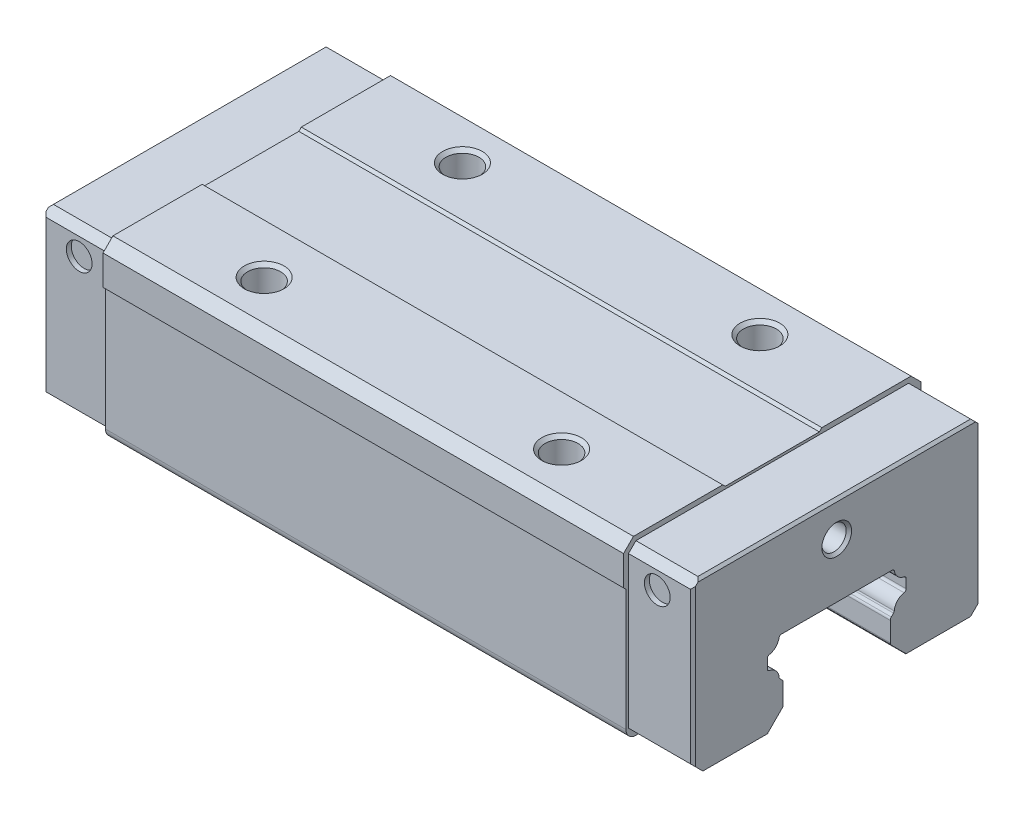
from build123d import *

# Parameters (mm, degrees)
BOSS_EXTRUDE1_DEPTH      = 52.5
BOSS_EXTRUDE1_DEPTH_BACK = 52.5
BOSS_EXTRUDE2_DEPTH      = 13
BOSS_EXTRUDE3_DEPTH      = 13
CUT_EXTRUDE1_DEPTH       = 65.5
CUT_EXTRUDE1_DEPTH_BACK  = 65.5
CUT_EXTRUDE2_DEPTH       = 29
CUT_EXTRUDE2_DEPTH_BACK  = 29
CUT_EXTRUDE3_DEPTH       = 29
CUT_EXTRUDE3_DEPTH_BACK  = 29
SKETCH7_R                = 2.6
CUT_EXTRUDE4_DEPTH       = 1
SKETCH8_R                = 2.6
CUT_EXTRUDE5_DEPTH       = 1
CUT_EXTRUDE6_START       = 1
SKETCH9_R                = 2.6
CUT_EXTRUDE6_DEPTH       = 1
CUT_EXTRUDE7_START       = 1
SKETCH10_R               = 2.6
CUT_EXTRUDE7_DEPTH       = 1
CUT_EXTRUDE8_DEPTH       = 35
CUT_EXTRUDE9_DEPTH       = 35


with BuildPart() as part:
    # Sketch1 → Boss-Extrude1 (new, two sides: drawn at the far end of the back side and taken through both)
    with BuildSketch(Plane(origin=(0, 0, 0), x_dir=(0, 0, -1), z_dir=(1, 0, 0)).offset(-BOSS_EXTRUDE1_DEPTH_BACK)):
        with BuildLine():
            Line((-30, 33), (-30, 27))
            Line((-30, 27), (-29.5, 26.5))
            Line((-29.5, 26.5), (-29.5, 2))
            ThreePointArc((-29.5, 2), (-28.914213562, 0.585786438), (-27.5, 0))
            Line((-27.5, 0), (27.5, 0))
            ThreePointArc((27.5, 0), (28.914213562, 0.585786438), (29.5, 2))
            Line((29.5, 2), (29.5, 26.5))
            Line((29.5, 26.5), (30, 27))
            Line((30, 27), (30, 33))
            Line((30, 33), (28, 35))
            Line((28, 35), (10, 35))
            Line((10, 35), (9.5, 34.5))
            Line((9.5, 34.5), (-9.5, 34.5))
            Line((-9.5, 34.5), (-10, 35))
            Line((-10, 35), (-28, 35))
            Line((-28, 35), (-30, 33))
        make_face()
    extrude(amount=BOSS_EXTRUDE1_DEPTH + BOSS_EXTRUDE1_DEPTH_BACK)

    # Sketch2 → Boss-Extrude2 (add)
    with BuildSketch(Plane(origin=(-65.5, 0, 0), x_dir=(0, 0, -1), z_dir=(1, 0, 0))):
        Polygon((-29, 2), (-27, 0), (27, 0), (29, 2), (29, 32.5), (27.5, 34), (-27.5, 34), (-29, 32.5), align=None)
    extrude(amount=BOSS_EXTRUDE2_DEPTH)

    # Sketch3 → Boss-Extrude3 (add)
    with BuildSketch(Plane(origin=(65.5, 0, 0), x_dir=(0, 0, -1), z_dir=(1, 0, 0))):
        Polygon((-29, 2), (-27, 0), (27, 0), (29, 2), (29, 32.5), (27.5, 34), (-27.5, 34), (-29, 32.5), align=None)
    extrude(amount=-BOSS_EXTRUDE3_DEPTH)

    # Sketch4 → Cut-Extrude1 (cut, two sides: drawn at the far end of the back side and taken through both)
    with BuildSketch(Plane(origin=(0, 0, 0), x_dir=(0, 0, -1), z_dir=(1, 0, 0)).offset(-CUT_EXTRUDE1_DEPTH_BACK)):
        with BuildLine():
            Line((-14, 13.148439), (-14, 11.35158))
            ThreePointArc((-14, 11.35158), (-13.885407957, 11.031881418), (-13.592386868, 10.860192277))
            ThreePointArc((-13.592386868, 10.860192277), (-12.229021504, 10.099202354), (-11.602627372, 8.66899217))
            ThreePointArc((-11.602627372, 8.66899217), (-11.559004129, 8.501191683), (-11.458152391, 8.360163609))
            Line((-11.458152391, 8.360163609), (-11.005017, 7.906991))
            ThreePointArc((-11.005017, 7.906991), (-10.852063473, 7.680418582), (-10.800003, 7.412054))
            Line((-10.800003, 7.412054), (-10.800003, 3.490777069))
            ThreePointArc((-10.800003, 3.490777069), (-10.853443426, 3.222114259), (-11.005628687, 2.994352913))
            Line((-11.005628687, 2.994352913), (-13.795574427, 0.204407575))
            ThreePointArc((-13.795574427, 0.204407575), (-13.946871354, -0.022023954), (-14, -0.289118216))
            Line((-14, -0.289118216), (-14, -5.5))
            Line((-14, -5.5), (-12.5, -7))
            Line((-12.5, -7), (-5.0000003, -7))
            Line((-5.0000003, -7), (-4.499985, -6.50000763))
            Line((-4.499985, -6.50000763), (4.499985, -6.50000763))
            Line((4.499985, -6.50000763), (5.0000003, -7))
            Line((5.0000003, -7), (12.5, -7))
            Line((12.5, -7), (14, -5.5))
            Line((14, -5.5), (14, -0.289118216))
            ThreePointArc((14, -0.289118216), (13.946871354, -0.022023954), (13.795574427, 0.204407575))
            Line((13.795574427, 0.204407575), (11.005628687, 2.994352913))
            ThreePointArc((11.005628687, 2.994352913), (10.853443426, 3.222114259), (10.800003, 3.490777069))
            Line((10.800003, 3.490777069), (10.800003, 7.412054))
            ThreePointArc((10.800003, 7.412054), (10.852063473, 7.680418582), (11.005017, 7.906991))
            Line((11.005017, 7.906991), (11.458152391, 8.360163609))
            ThreePointArc((11.458152391, 8.360163609), (11.559004129, 8.501191683), (11.602627372, 8.66899217))
            ThreePointArc((11.602627372, 8.66899217), (12.229021504, 10.099202354), (13.592386868, 10.860192277))
            ThreePointArc((13.592386868, 10.860192277), (13.885407957, 11.031881418), (14, 11.35158))
            Line((14, 11.35158), (14, 13.148439))
            ThreePointArc((14, 13.148439), (13.886532321, 13.469052961), (13.5924176, 13.639829881))
            ThreePointArc((13.5924176, 13.639829881), (12.312672018, 14.314596081), (11.635789981, 15.593223817))
            ThreePointArc((11.635789981, 15.593223817), (11.466717508, 15.887148006), (11.146965482, 16))
            Line((11.146965482, 16), (-11.146965482, 16))
            ThreePointArc((-11.146965482, 16), (-11.466717508, 15.887148006), (-11.635789981, 15.593223817))
            ThreePointArc((-11.635789981, 15.593223817), (-12.312672018, 14.314596081), (-13.5924176, 13.639829881))
            ThreePointArc((-13.5924176, 13.639829881), (-13.886532321, 13.469052961), (-14, 13.148439))
        make_face()
    extrude(amount=CUT_EXTRUDE1_DEPTH + CUT_EXTRUDE1_DEPTH_BACK, mode=Mode.SUBTRACT)

    # Sketch5 → Cut-Extrude2 (cut, two sides: drawn at the far end of the back side and taken through both)
    with BuildSketch(Plane.XY.offset(-CUT_EXTRUDE2_DEPTH_BACK)):
        Polygon((-65.5, 33.5), (-65, 34), (-65.5, 34), align=None)
    extrude(amount=CUT_EXTRUDE2_DEPTH + CUT_EXTRUDE2_DEPTH_BACK, mode=Mode.SUBTRACT)

    # Sketch6 → Cut-Extrude3 (cut, two sides: drawn at the far end of the back side and taken through both)
    with BuildSketch(Plane.XY.offset(-CUT_EXTRUDE3_DEPTH_BACK)):
        Polygon((65, 34), (65.5, 33.5), (65.5, 34), align=None)
    extrude(amount=CUT_EXTRUDE3_DEPTH + CUT_EXTRUDE3_DEPTH_BACK, mode=Mode.SUBTRACT)

    # Sketch7 → Cut-Extrude4 (cut)
    with BuildSketch(Plane.XY.offset(29)):
        with Locations((58.3, 29)):
            Circle(SKETCH7_R)
    extrude(amount=-CUT_EXTRUDE4_DEPTH, mode=Mode.SUBTRACT)

    # Sketch8 → Cut-Extrude5 (cut)
    with BuildSketch(Plane.XY.offset(29)):
        with Locations((-58.3, 29)):
            Circle(SKETCH8_R)
    extrude(amount=-CUT_EXTRUDE5_DEPTH, mode=Mode.SUBTRACT)

    # Sketch9 → Cut-Extrude6 (cut)
    with BuildSketch(Plane.XY.offset(-29).offset(CUT_EXTRUDE6_START)):
        with Locations((58.3, 29)):
            Circle(SKETCH9_R)
    extrude(amount=-CUT_EXTRUDE6_DEPTH, mode=Mode.SUBTRACT)

    # Sketch10 → Cut-Extrude7 (cut)
    with BuildSketch(Plane.XY.offset(-29).offset(CUT_EXTRUDE7_START)):
        with Locations((-58.3, 29)):
            Circle(SKETCH10_R)
    extrude(amount=-CUT_EXTRUDE7_DEPTH, mode=Mode.SUBTRACT)

    # Sketch11 → Cut-Revolve1 (revolve, cut)
    with BuildSketch(Plane.XY):
        Polygon((-65.5, 27), (-65.5, 30), (-64.9585, 29.4585), (-59.5, 29.4585), (-58.080584363, 27), align=None)
    revolve(axis=Axis((-58.080584363, 27, 0), (-1, 0, 0)), mode=Mode.SUBTRACT)

    # Sketch12 → Cut-Revolve2 (revolve, cut)
    with BuildSketch(Plane.XY):
        Polygon((58.080584363, 27), (59.5, 29.4585), (64.9585, 29.4585), (65.5, 30), (65.5, 27), align=None)
    revolve(axis=Axis((65.5, 27, 0), (-1, 0, 0)), mode=Mode.SUBTRACT)

    # Sketch13 → Cut-Revolve3 (revolve, cut)
    with BuildSketch(Plane.XY.offset(20)):
        Polygon((-30, 35), (-26, 35), (-26.6765, 34.3235), (-26.6765, 25.4), (-30, 23.48117638), align=None)
    revolve(axis=Axis((-30, 23.48117638, 20), (0, 1, 0)), mode=Mode.SUBTRACT)

    # Sketch14 → Cut-Revolve4 (revolve, cut)
    with BuildSketch(Plane.XY.offset(20)):
        Polygon((30, 35), (34, 35), (33.3235, 34.3235), (33.3235, 25.4), (30, 23.48117638), align=None)
    revolve(axis=Axis((30, 23.48117638, 20), (0, 1, 0)), mode=Mode.SUBTRACT)

    # Sketch15 → Cut-Revolve5 (revolve, cut)
    with BuildSketch(Plane.XY.offset(-20)):
        Polygon((-30, 35), (-26, 35), (-26.6765, 34.3235), (-26.6765, 25.4), (-30, 23.48117638), align=None)
    revolve(axis=Axis((-30, 23.48117638, -20), (0, 1, 0)), mode=Mode.SUBTRACT)

    # Sketch16 → Cut-Revolve6 (revolve, cut)
    with BuildSketch(Plane.XY.offset(-20)):
        Polygon((30, 35), (34, 35), (33.3235, 34.3235), (33.3235, 25.4), (30, 23.48117638), align=None)
    revolve(axis=Axis((30, 23.48117638, -20), (0, 1, 0)), mode=Mode.SUBTRACT)

    # Sketch17 → Cut-Extrude8 (cut)
    with BuildSketch(Plane(origin=(0, 0, 0), x_dir=(1, 0, 0), z_dir=(0, 1, 0))):
        Polygon((-130.5, 29.5), (-130.5, -29.5), (-65, -29.5), (-65, -29), (-65.5, -28.5), (-65.5, -29), (-130, -29), (-130, 29), (-65.5, 29), (-65.5, 28.5), (-65, 29), (-65, 29.5), align=None)
    extrude(amount=CUT_EXTRUDE8_DEPTH, mode=Mode.SUBTRACT)

    # Sketch18 → Cut-Extrude9 (cut)
    with BuildSketch(Plane(origin=(0, 0, 0), x_dir=(1, 0, 0), z_dir=(0, 1, 0))):
        Polygon((65, -29), (65, -29.5), (130.5, -29.5), (130.5, 29.5), (65, 29.5), (65, 29), (65.5, 28.5), (65.5, 29), (130, 29), (130, -29), (65.5, -29), (65.5, -28.5), align=None)
    extrude(amount=CUT_EXTRUDE9_DEPTH, mode=Mode.SUBTRACT)


solid = part.part
